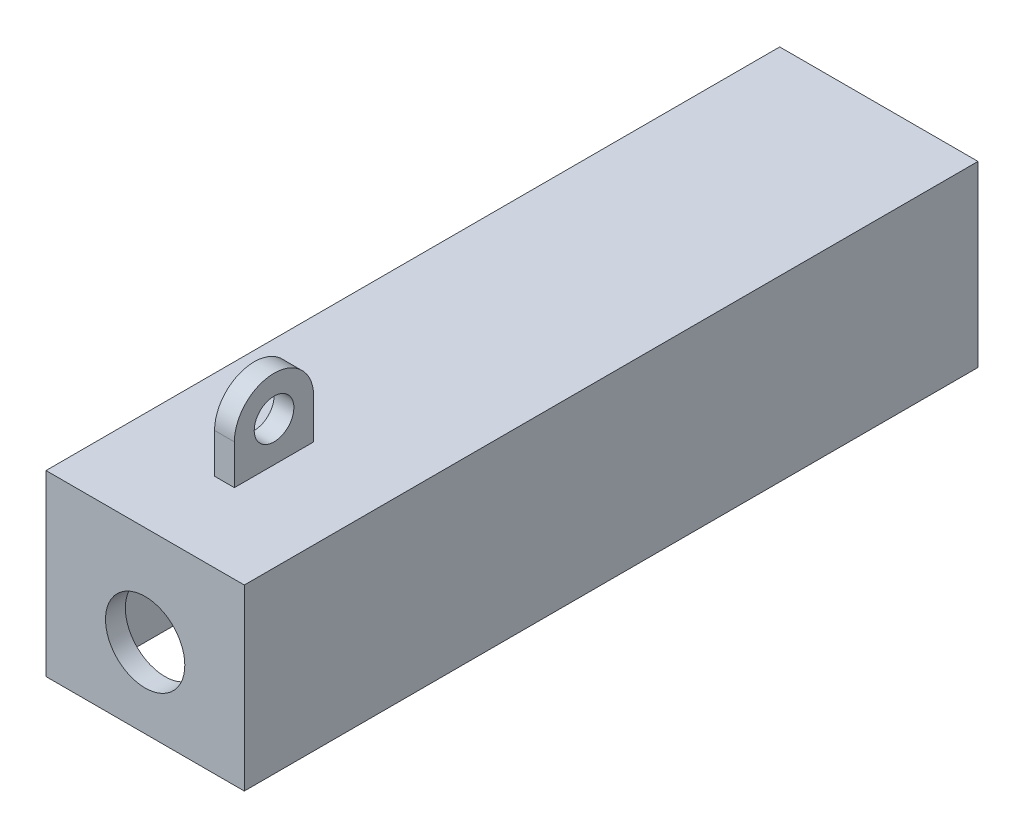
from build123d import *

# Parameters (mm, degrees)
SKETCH1_W           = 31.75
SKETCH1_H           = 28.575
BOSS_EXTRUDE1_DEPTH = 3.175
SKETCH2_R           = 6.35
CUT_EXTRUDE1_DEPTH  = 28.423991451
BOSS_EXTRUDE2_DEPTH = 114.3
SKETCH4_W           = 3.175
SKETCH4_H           = 12.7
BOSS_EXTRUDE3_DEPTH = 12.7
SKETCH5_R           = 3.175
CUT_EXTRUDE2_DEPTH  = 119.165117032


with BuildPart() as part:
    # Sketch1 → Boss-Extrude1 (new body)
    with BuildSketch(Plane.XY):
        with Locations((-5.47882926, -2.624290504)):
            Rectangle(SKETCH1_W, SKETCH1_H)
    extrude(amount=BOSS_EXTRUDE1_DEPTH)

    # Sketch2 → Cut-Extrude1 (cut, through all)
    with BuildSketch(Plane.XY.offset(3.175)):
        with Locations((-5.47882926, -4.211790504)):
            Circle(SKETCH2_R)
    extrude(amount=-CUT_EXTRUDE1_DEPTH, mode=Mode.SUBTRACT)

    # Sketch3 → Boss-Extrude2 (add)
    with BuildSketch(Plane(origin=(0, 0, 0), x_dir=(-1, 0, 0), z_dir=(0, 0, -1))):
        Polygon((21.35382926, -16.911790504), (18.17882926, -16.911790504), (18.17882926, 8.488209496), (-7.22117074, 8.488209496), (-7.22117074, -16.911790504), (-10.39617074, -16.911790504), (-10.39617074, 11.663209496), (21.35382926, 11.663209496), align=None)
    extrude(amount=BOSS_EXTRUDE2_DEPTH)

    # Sketch4 → Boss-Extrude3 (add)
    with BuildSketch(Plane(origin=(0, 11.663209496, 0), x_dir=(1, 0, 0), z_dir=(0, 1, 0))):
        with Locations((-5.47882926, 15.875)):
            Rectangle(SKETCH4_W, SKETCH4_H)
    extrude(amount=BOSS_EXTRUDE3_DEPTH)

    # Sketch5 → Cut-Extrude2 (cut, through all)
    with BuildSketch(Plane(origin=(-3.89132926, 0, 0), x_dir=(0, 0, -1), z_dir=(1, 0, 0))):
        with BuildLine():
            ThreePointArc((15.875, 24.363209496), (20.365128061, 22.503337556), (22.225, 18.013209496))
            Line((22.225, 18.013209496), (22.225, 24.363209496))
            Line((22.225, 24.363209496), (15.875, 24.363209496))
        make_face()
        with BuildLine():
            ThreePointArc((9.525, 18.013209496), (11.384871939, 22.503337556), (15.875, 24.363209496))
            Line((15.875, 24.363209496), (9.525, 24.363209496))
            Line((9.525, 24.363209496), (9.525, 18.013209496))
        make_face()
        with Locations((15.875, 18.013209496)):
            Circle(SKETCH5_R)
    extrude(amount=-CUT_EXTRUDE2_DEPTH, mode=Mode.SUBTRACT)


solid = part.part
